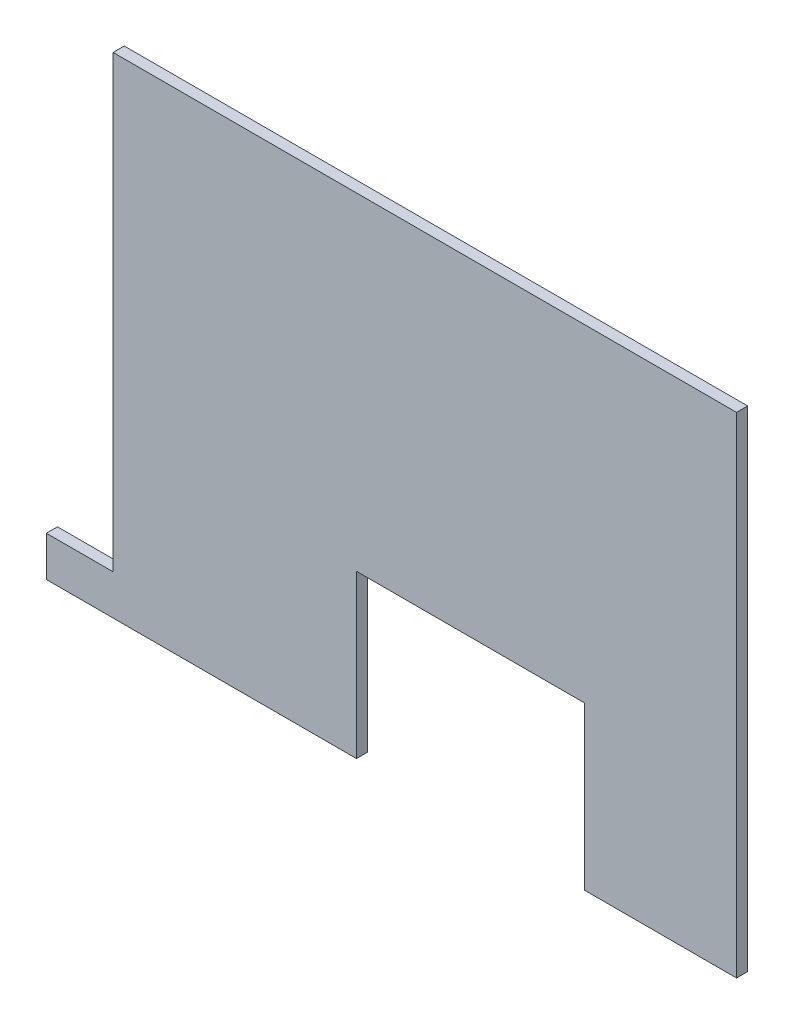
from build123d import *

# Parameters (mm, degrees)
BOSS_EXTRUDE1_DEPTH = 5


with BuildPart() as part:
    # Sketch1 → Boss-Extrude1 (new body)
    with BuildSketch(Plane.XY):
        Polygon((-140, 110), (-140, -92), (-170, -92), (-170, -110), (-30.698160058, -110), (-30.698160058, -37.165278239), (71.610514859, -37.165278239), (71.610514859, -110), (140, -110), (140, 110), align=None)
    extrude(amount=BOSS_EXTRUDE1_DEPTH)


solid = part.part
